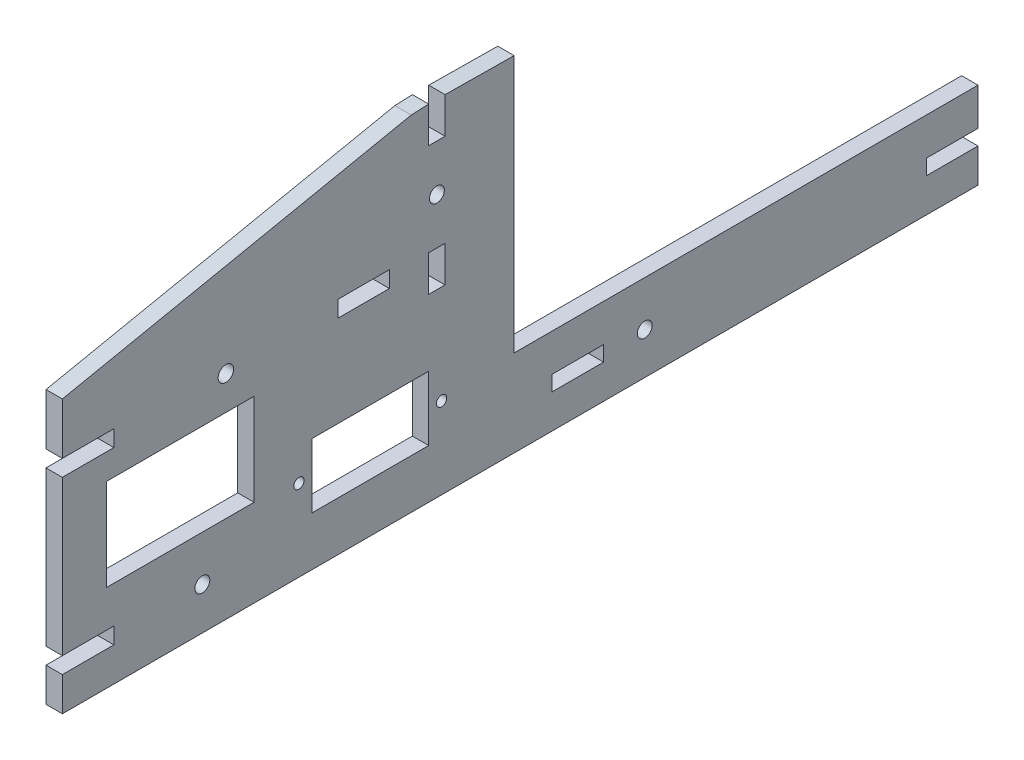
from build123d import *

# Parameters (mm, degrees)
SKETCH1_R      = 1.45
SKETCH1_R_2    = 1.44992108
SKETCH1_R_3    = 1
SKETCH1_R_4    = 1.5
SKETCH1_W      = 22.7
SKETCH1_H      = 12.5
SKETCH1_W_2    = 10
SKETCH1_H_2    = 2.952902408
SKETCH1_H_3    = 3.175
SKETCH1_W_3    = 3.175
SKETCH1_H_4    = 7
SKETCH1_W_4    = 28.701572838
SKETCH1_H_5    = 17.835977406
EXTRUDE1_DEPTH = 3.175


with BuildPart() as part:
    # Sketch1 → Extrude1 (new body)
    with BuildSketch(Plane(origin=(0, 0, 0), x_dir=(0, 0, -1), z_dir=(1, 0, 0))):
        Polygon((71.197724246, -30.438774567), (71.197724246, -37.036692127), (-106.598842421, -37.036692127), (-106.598842421, -30.436692127), (-96.598842421, -30.436692127), (-96.598842421, -27.261692127), (-106.598842421, -27.261692127), (-106.598842421, 2.738307873), (-96.598842421, 2.738307873), (-96.598842421, 5.913307873), (-106.598842421, 5.913307873), (-106.598842421, 15.913307873), (-38.865609087, 29.788307873), (-35.457953974, 29.936573589), (-35.457953974, 22.936573589), (-32.282953974, 22.936573589), (-32.282953974, 29.936573589), (-18.865609087, 29.788307873), (-18.865609087, -20.211692127), (71.197724246, -20.211692127), (71.197724246, -27.483789719), (61.197724246, -27.483789719), (61.197724246, -30.438774567), align=None)
        with Locations((-79.418842421, -28.849192127)):
            Circle(SKETCH1_R, mode=Mode.SUBTRACT)
        with Locations((6.481057579, -28.960240923)):
            Circle(SKETCH1_R_2, mode=Mode.SUBTRACT)
        with Locations((-60.661798953, -21.233789719)):
            Circle(SKETCH1_R_3, mode=Mode.SUBTRACT)
        with Locations((-32.961798953, -21.233789719)):
            Circle(SKETCH1_R_3, mode=Mode.SUBTRACT)
        with Locations((-33.870453974, 13.93657382)):
            Circle(SKETCH1_R, mode=Mode.SUBTRACT)
        with Locations((-74.848842421, 4.325807873)):
            Circle(SKETCH1_R_4, mode=Mode.SUBTRACT)
        with Locations((-46.811798953, -21.233789719)):
            Rectangle(SKETCH1_W, SKETCH1_H, mode=Mode.SUBTRACT)
        with Locations((-6.510665386, -28.960240923)):
            Rectangle(SKETCH1_W_2, SKETCH1_H_2, mode=Mode.SUBTRACT)
        with Locations((-48.098842421, 4.325807873)):
            Rectangle(SKETCH1_W_2, SKETCH1_H_3, mode=Mode.SUBTRACT)
        with Locations((-33.874298953, 1.43657382)):
            Rectangle(SKETCH1_W_3, SKETCH1_H_4, mode=Mode.SUBTRACT)
        with Locations((-83.72320649, -11.157017929)):
            Rectangle(SKETCH1_W_4, SKETCH1_H_5, mode=Mode.SUBTRACT)
    extrude(amount=EXTRUDE1_DEPTH)


solid = part.part
